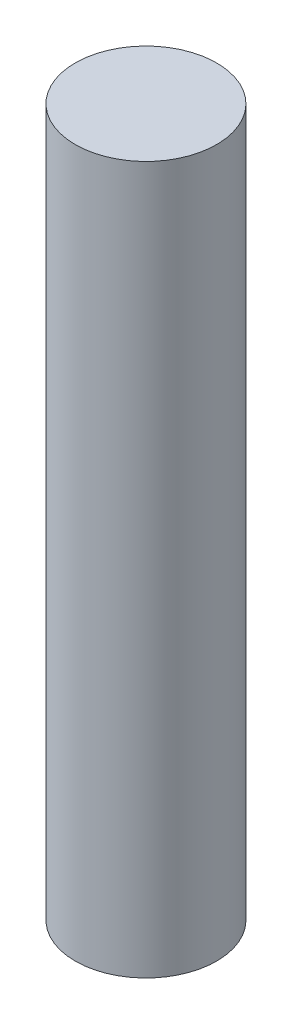
from build123d import *

# Parameters (mm, degrees)
SKETCH_1_R      = 1
EXTRUDE_1_DEPTH = 10


with BuildPart() as part:
    # 草图1 → 凸台-拉伸1 (new body)
    with BuildSketch(Plane(origin=(0, 0, 0), x_dir=(1, 0, 0), z_dir=(0, 1, 0))):
        with Locations(Location((0, 0, 0), (0, 0, 270))):
            Circle(SKETCH_1_R)
    extrude(amount=EXTRUDE_1_DEPTH)


solid = part.part
